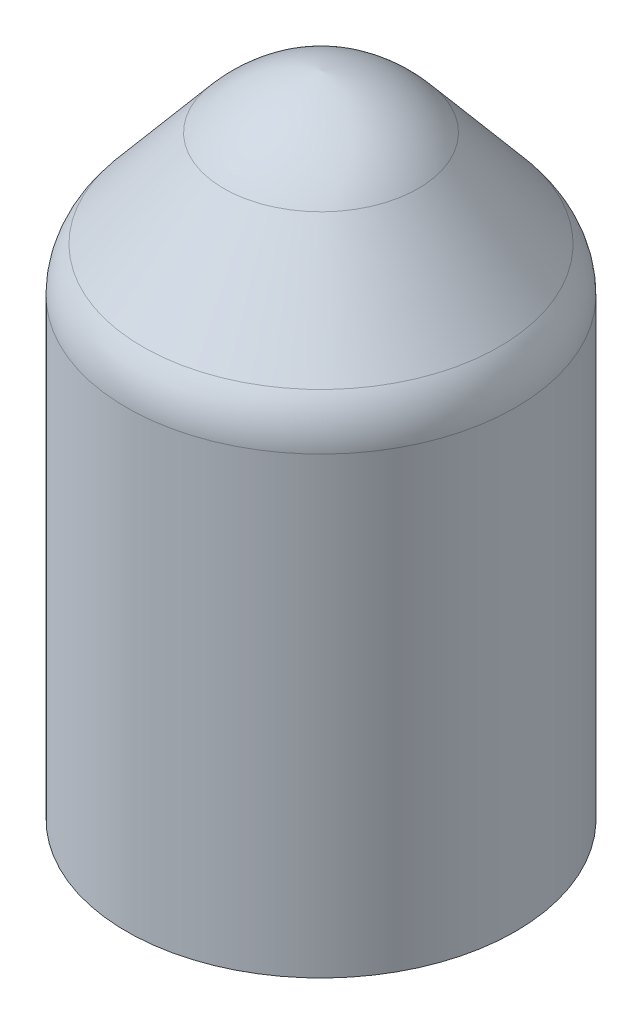
from build123d import *

# Parameters (mm, degrees)
SHELL3_T = -2


with BuildPart() as part:
    # Sketch1 → Revolve3 (revolve)
    with BuildSketch(Plane.XY, mode=Mode.PRIVATE) as revolve3_sk:
        with BuildLine():
            Line((55, 153.737387097), (30, 183.531226912))
            ThreePointArc((30, 183.531226912), (16.543627917, 194.577531336), (0, 200))
            Line((0, 200), (0, 140))
            Line((0, 140), (0, 0))
            Line((0, 0), (60, 0))
            Line((60, 0), (60, 140))
            ThreePointArc((60, 140), (58.711135995, 147.309511), (55, 153.737387097))
        make_face()
    revolve(revolve3_sk.sketch.rotate(Axis((0, 200, 0), (0, -1, 0)), 180), axis=Axis((0, 200, 0), (0, -1, 0)))

    # Shell3
    shell3_openings = [part.faces().sort_by_distance(p)[0] for p in [
        (0, 0, 0),
    ]]
    offset(amount=SHELL3_T, openings=shell3_openings, kind=Kind.INTERSECTION)


solid = part.part
